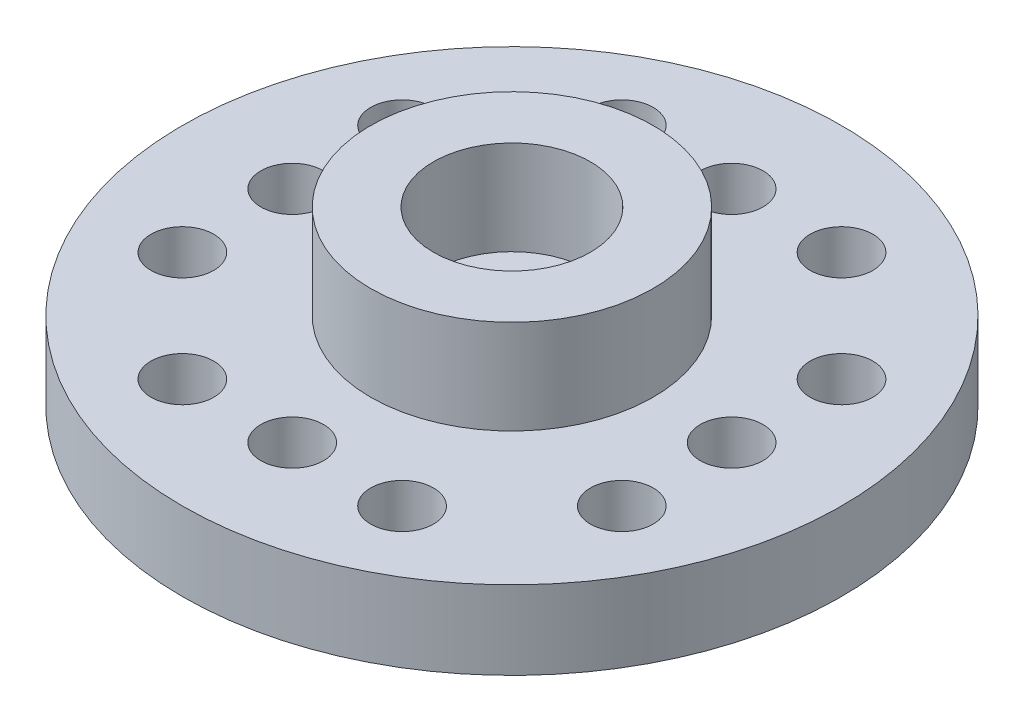
from build123d import *

# Parameters (mm, degrees)
SKETCH1_R           = 10.5
SKETCH1_R_2         = 1.5
BOSS_EXTRUDE1_DEPTH = 2.5
SKETCH2_R           = 4.5
SKETCH2_R_2         = 2.5
BOSS_EXTRUDE2_DEPTH = 3
CUT_EXTRUDE1_REACH  = 17.835
SKETCH3_R           = 1


with BuildPart() as part:
    # Sketch1 → Boss-Extrude1 (new body)
    with BuildSketch(Plane(origin=(0, 0, 0), x_dir=(1, 0, 0), z_dir=(0, 1, 0))):
        with Locations(Location((0, 0, 0), (0, 0, 270))):
            Circle(SKETCH1_R)
        with Locations(Location((0, 0, 0), (0, 0, 270))):
            Circle(SKETCH1_R_2, mode=Mode.SUBTRACT)
    extrude(amount=BOSS_EXTRUDE1_DEPTH)

    # Sketch2 → Boss-Extrude2 (add)
    with BuildSketch(Plane(origin=(0, 2.5, 0), x_dir=(1, 0, 0), z_dir=(0, 1, 0))):
        with Locations(Location((0, 0, 0), (0, 0, 270))):
            Circle(SKETCH2_R)
        with Locations(Location((0, 0, 0), (0, 0, 270))):
            Circle(SKETCH2_R_2, mode=Mode.SUBTRACT)
    extrude(amount=BOSS_EXTRUDE2_DEPTH)

    # Sketch3 → Cut-Extrude1 (cut, up to next)
    with BuildSketch(Plane.XZ, mode=Mode.PRIVATE) as cut_extrude1_sk1:
        with Locations(Location((-3.5, 7, 0), (0, 0, 270))):
            Circle(SKETCH3_R)
    cut_extrude1_tool1 = extrude(cut_extrude1_sk1.sketch, amount=-CUT_EXTRUDE1_REACH, mode=Mode.PRIVATE) & part.part
    # Sketch3 → Cut-Extrude1 (cut, up to next)
    with BuildSketch(Plane.XZ, mode=Mode.PRIVATE) as cut_extrude1_sk2:
        with Locations(Location((0, 7, 0), (0, 0, 270))):
            Circle(SKETCH3_R)
    cut_extrude1_tool2 = extrude(cut_extrude1_sk2.sketch, amount=-CUT_EXTRUDE1_REACH, mode=Mode.PRIVATE) & part.part
    # Sketch3 → Cut-Extrude1 (cut, up to next)
    with BuildSketch(Plane.XZ, mode=Mode.PRIVATE) as cut_extrude1_sk3:
        with Locations(Location((3.5, 7, 0), (0, 0, 270))):
            Circle(SKETCH3_R)
    cut_extrude1_tool3 = extrude(cut_extrude1_sk3.sketch, amount=-CUT_EXTRUDE1_REACH, mode=Mode.PRIVATE) & part.part
    # Sketch3 → Cut-Extrude1 (cut, up to next)
    with BuildSketch(Plane.XZ, mode=Mode.PRIVATE) as cut_extrude1_sk4:
        with Locations(Location((7, -3.5, 0), (0, 0, 270))):
            Circle(SKETCH3_R)
    cut_extrude1_tool4 = extrude(cut_extrude1_sk4.sketch, amount=-CUT_EXTRUDE1_REACH, mode=Mode.PRIVATE) & part.part
    # Sketch3 → Cut-Extrude1 (cut, up to next)
    with BuildSketch(Plane.XZ, mode=Mode.PRIVATE) as cut_extrude1_sk5:
        with Locations(Location((7, 0, 0), (0, 0, 270))):
            Circle(SKETCH3_R)
    cut_extrude1_tool5 = extrude(cut_extrude1_sk5.sketch, amount=-CUT_EXTRUDE1_REACH, mode=Mode.PRIVATE) & part.part
    # Sketch3 → Cut-Extrude1 (cut, up to next)
    with BuildSketch(Plane.XZ, mode=Mode.PRIVATE) as cut_extrude1_sk6:
        with Locations(Location((7, 3.5, 0), (0, 0, 270))):
            Circle(SKETCH3_R)
    cut_extrude1_tool6 = extrude(cut_extrude1_sk6.sketch, amount=-CUT_EXTRUDE1_REACH, mode=Mode.PRIVATE) & part.part
    # Sketch3 → Cut-Extrude1 (cut, up to next)
    with BuildSketch(Plane.XZ, mode=Mode.PRIVATE) as cut_extrude1_sk7:
        with Locations(Location((-3.5, -7, 0), (0, 0, 270))):
            Circle(SKETCH3_R)
    cut_extrude1_tool7 = extrude(cut_extrude1_sk7.sketch, amount=-CUT_EXTRUDE1_REACH, mode=Mode.PRIVATE) & part.part
    # Sketch3 → Cut-Extrude1 (cut, up to next)
    with BuildSketch(Plane.XZ, mode=Mode.PRIVATE) as cut_extrude1_sk8:
        with Locations(Location((0, -7, 0), (0, 0, 270))):
            Circle(SKETCH3_R)
    cut_extrude1_tool8 = extrude(cut_extrude1_sk8.sketch, amount=-CUT_EXTRUDE1_REACH, mode=Mode.PRIVATE) & part.part
    # Sketch3 → Cut-Extrude1 (cut, up to next)
    with BuildSketch(Plane.XZ, mode=Mode.PRIVATE) as cut_extrude1_sk9:
        with Locations(Location((3.5, -7, 0), (0, 0, 270))):
            Circle(SKETCH3_R)
    cut_extrude1_tool9 = extrude(cut_extrude1_sk9.sketch, amount=-CUT_EXTRUDE1_REACH, mode=Mode.PRIVATE) & part.part
    # Sketch3 → Cut-Extrude1 (cut, up to next)
    with BuildSketch(Plane.XZ, mode=Mode.PRIVATE) as cut_extrude1_sk10:
        with Locations(Location((-7, 3.5, 0), (0, 0, 270))):
            Circle(SKETCH3_R)
    cut_extrude1_tool10 = extrude(cut_extrude1_sk10.sketch, amount=-CUT_EXTRUDE1_REACH, mode=Mode.PRIVATE) & part.part
    # Sketch3 → Cut-Extrude1 (cut, up to next)
    with BuildSketch(Plane.XZ, mode=Mode.PRIVATE) as cut_extrude1_sk11:
        with Locations(Location((-7, 0, 0), (0, 0, 270))):
            Circle(SKETCH3_R)
    cut_extrude1_tool11 = extrude(cut_extrude1_sk11.sketch, amount=-CUT_EXTRUDE1_REACH, mode=Mode.PRIVATE) & part.part
    # Sketch3 → Cut-Extrude1 (cut, up to next)
    with BuildSketch(Plane.XZ, mode=Mode.PRIVATE) as cut_extrude1_sk12:
        with Locations(Location((-7, -3.5, 0), (0, 0, 270))):
            Circle(SKETCH3_R)
    cut_extrude1_tool12 = extrude(cut_extrude1_sk12.sketch, amount=-CUT_EXTRUDE1_REACH, mode=Mode.PRIVATE) & part.part
    add(cut_extrude1_tool1.solids().sort_by_distance((-3.5, 0, 7))[0], mode=Mode.SUBTRACT)
    add(cut_extrude1_tool2.solids().sort_by_distance((0, 0, 7))[0], mode=Mode.SUBTRACT)
    add(cut_extrude1_tool3.solids().sort_by_distance((3.5, 0, 7))[0], mode=Mode.SUBTRACT)
    add(cut_extrude1_tool4.solids().sort_by_distance((7, 0, -3.5))[0], mode=Mode.SUBTRACT)
    add(cut_extrude1_tool5.solids().sort_by_distance((7, 0, 0))[0], mode=Mode.SUBTRACT)
    add(cut_extrude1_tool6.solids().sort_by_distance((7, 0, 3.5))[0], mode=Mode.SUBTRACT)
    add(cut_extrude1_tool7.solids().sort_by_distance((-3.5, 0, -7))[0], mode=Mode.SUBTRACT)
    add(cut_extrude1_tool8.solids().sort_by_distance((0, 0, -7))[0], mode=Mode.SUBTRACT)
    add(cut_extrude1_tool9.solids().sort_by_distance((3.5, 0, -7))[0], mode=Mode.SUBTRACT)
    add(cut_extrude1_tool10.solids().sort_by_distance((-7, 0, 3.5))[0], mode=Mode.SUBTRACT)
    add(cut_extrude1_tool11.solids().sort_by_distance((-7, 0, 0))[0], mode=Mode.SUBTRACT)
    add(cut_extrude1_tool12.solids().sort_by_distance((-7, 0, -3.5))[0], mode=Mode.SUBTRACT)


solid = part.part
